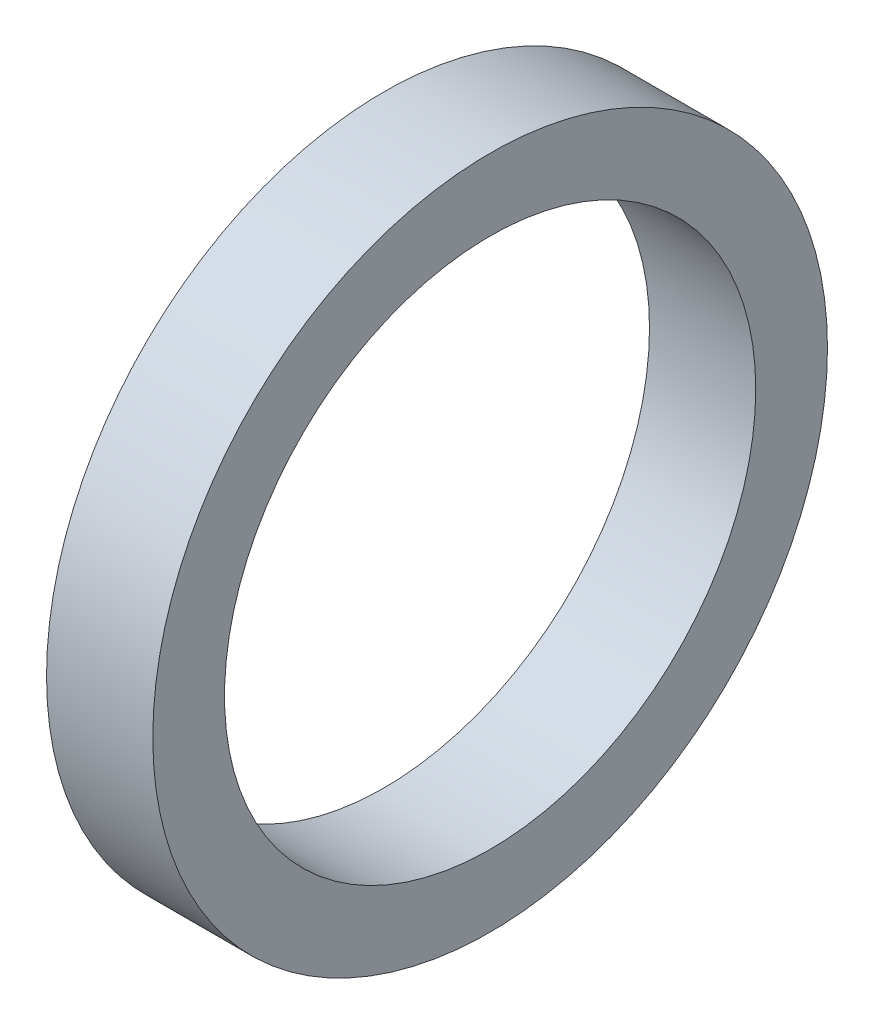
from build123d import *

# Parameters (mm, degrees)
SKETCH1_R           = 19.05
SKETCH1_R_2         = 15
BOSS_EXTRUDE1_DEPTH = 6


with BuildPart() as part:
    # Sketch1 → Boss-Extrude1 (new body)
    with BuildSketch(Plane(origin=(0, 0, 0), x_dir=(0, 0, -1), z_dir=(1, 0, 0))):
        Circle(SKETCH1_R)
        Circle(SKETCH1_R_2, mode=Mode.SUBTRACT)
    extrude(amount=BOSS_EXTRUDE1_DEPTH)


solid = part.part
